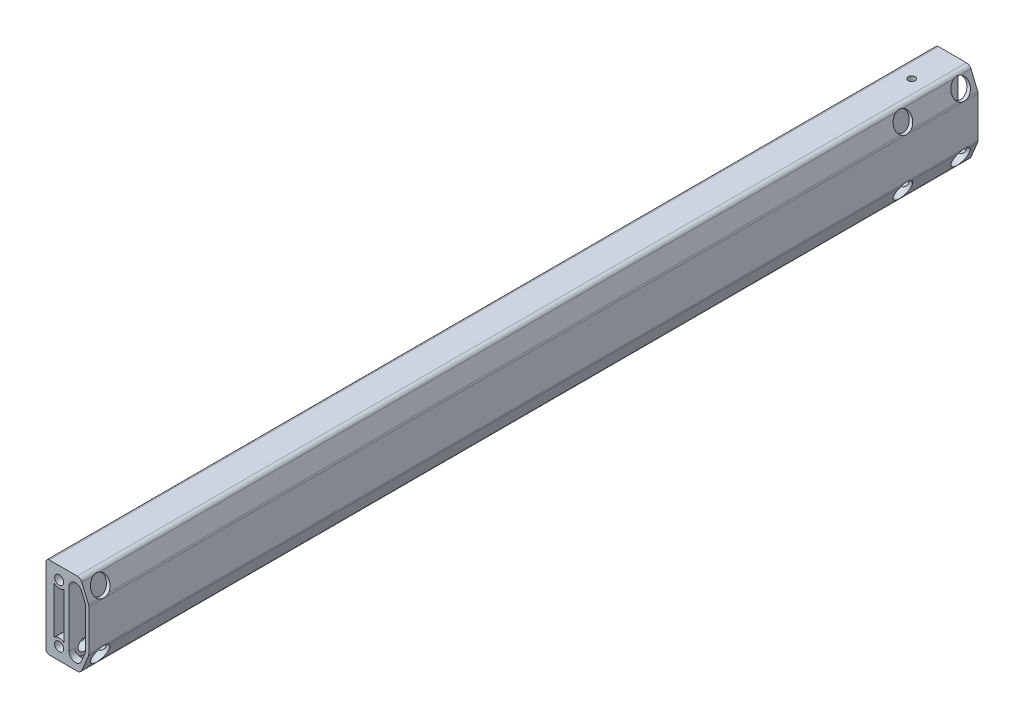
from build123d import *

# Parameters (mm, degrees)
SKETCH_1_R             = 2.75
EXTRUDE_1_DEPTH        = 540
CUT_EXTRUDE_2_DEPTH    = 2.5
SKETCH_3_R             = 3.5
CUT_EXTRUDE_3_DEPTH    = 1297.387836991
SKETCH_4_R             = 5.5
CUT_EXTRUDE_4_DEPTH    = 12
HOLE_WIZARD_M5_1_D     = 4.2
HOLE_WIZARD_M5_1_DEPTH = 12.4
HOLE_WIZARD_M5_1_TIP   = 1.2618073
HOLE_WIZARD_M5_2_D     = 4.2
HOLE_WIZARD_M5_2_DEPTH = 12.4
HOLE_WIZARD_M5_2_TIP   = 1.2618073


with BuildPart() as part:
    # 草图1 → 拉伸1 (new body)
    with BuildSketch(Plane.XY):
        with BuildLine():
            Line((1279.954850036, 1143.28070675), (1279.954850036, 1130.28070675))
            ThreePointArc((1279.954850036, 1130.28070675), (1280.540636473, 1128.866493188), (1281.954850036, 1128.28070675))
            Line((1281.954850036, 1128.28070675), (1298.954850036, 1128.28070675))
            ThreePointArc((1298.954850036, 1128.28070675), (1300.618950624, 1128.784555867), (1301.724080805, 1130.126860596))
            Line((1301.724080805, 1130.126860596), (1305.724080805, 1139.726860596))
            ThreePointArc((1305.724080805, 1139.726860596), (1305.896592063, 1140.292358345), (1305.954850036, 1140.88070675))
            Line((1305.954850036, 1140.88070675), (1305.954850036, 1165.68070675))
            ThreePointArc((1305.954850036, 1165.68070675), (1305.896592063, 1166.269055155), (1305.724080805, 1166.834552904))
            Line((1305.724080805, 1166.834552904), (1301.724080805, 1176.434552904))
            ThreePointArc((1301.724080805, 1176.434552904), (1300.618950624, 1177.776857633), (1298.954850036, 1178.28070675))
            Line((1298.954850036, 1178.28070675), (1281.954850036, 1178.28070675))
            ThreePointArc((1281.954850036, 1178.28070675), (1280.540636473, 1177.694920312), (1279.954850036, 1176.28070675))
            Line((1279.954850036, 1176.28070675), (1279.954850036, 1163.28070675))
            Line((1279.954850036, 1163.28070675), (1279.954850036, 1143.28070675))
        make_face()
        with Locations((1287.954850036, 1135.78070675)):
            Circle(SKETCH_1_R, mode=Mode.SUBTRACT)
        with Locations((1287.954850036, 1170.78070675)):
            Circle(SKETCH_1_R, mode=Mode.SUBTRACT)
        with BuildLine():
            Line((1284.954850036, 1167.426604784), (1284.954850036, 1139.134808716))
            ThreePointArc((1284.954850036, 1139.134808716), (1287.954850036, 1140.28070675), (1290.954850036, 1139.134808716))
            Line((1290.954850036, 1139.134808716), (1290.954850036, 1167.426604784))
            ThreePointArc((1290.954850036, 1167.426604784), (1287.954850036, 1166.28070675), (1284.954850036, 1167.426604784))
        make_face(mode=Mode.SUBTRACT)
        with BuildLine():
            Line((1293.954850036, 1170.38070675), (1293.954850036, 1136.18070675))
            ThreePointArc((1293.954850036, 1136.18070675), (1297.089997109, 1132.356442115), (1301.454850036, 1134.68070675))
            Line((1301.454850036, 1134.68070675), (1303.877926959, 1140.496091365))
            ThreePointArc((1303.877926959, 1140.496091365), (1303.935430711, 1140.684590615), (1303.954850036, 1140.88070675))
            Line((1303.954850036, 1140.88070675), (1303.954850036, 1165.68070675))
            ThreePointArc((1303.954850036, 1165.68070675), (1303.935430711, 1165.876822885), (1303.877926959, 1166.065322135))
            Line((1303.877926959, 1166.065322135), (1301.454850036, 1171.88070675))
            ThreePointArc((1301.454850036, 1171.88070675), (1297.089997109, 1174.204971385), (1293.954850036, 1170.38070675))
        make_face(mode=Mode.SUBTRACT)
    extrude(amount=-EXTRUDE_1_DEPTH)

    # 草图2 → 拉伸2 (cut)
    with BuildSketch(Plane.ZY.offset(-1279.954850036)):
        with BuildLine():
            Line((-540, 1163.28070675), (-485, 1163.28070675))
            ThreePointArc((-485, 1163.28070675), (-475, 1153.28070675), (-485, 1143.28070675))
            Line((-485, 1143.28070675), (-540, 1143.28070675))
            Line((-540, 1143.28070675), (-540, 1163.28070675))
        make_face()
    extrude(amount=-CUT_EXTRUDE_2_DEPTH, mode=Mode.SUBTRACT)

    # 草图3 → 拉伸3 (cut, through all)
    with BuildSketch(Plane(origin=(1305.954850036, 0, 0), x_dir=(0, 0, -1), z_dir=(1, 0, 0))):
        with Locations(Location((531.5, 1171.28070675, 0), (0, 0, 90))):
            Circle(SKETCH_3_R)
        with Locations(Location((496.5, 1171.28070675, 0), (0, 0, 90))):
            Circle(SKETCH_3_R)
        with Locations(Location((531.5, 1135.28070675, 0), (0, 0, 90))):
            Circle(SKETCH_3_R)
        with Locations(Location((496.5, 1135.28070675, 0), (0, 0, 90))):
            Circle(SKETCH_3_R)
        with Locations(Location((9, 1171.28070675, 0), (0, 0, 90))):
            Circle(SKETCH_3_R)
        with Locations(Location((9, 1135.28070675, 0), (0, 0, 90))):
            Circle(SKETCH_3_R)
    extrude(amount=-CUT_EXTRUDE_3_DEPTH, mode=Mode.SUBTRACT)

    # 草图4 → 拉伸4 (cut)
    with BuildSketch(Plane(origin=(1305.954850036, 0, 0), x_dir=(0, 0, -1), z_dir=(1, 0, 0))):
        with Locations(Location((496.5, 1171.28070675, 0), (0, 0, 69.564033963))):
            Circle(SKETCH_4_R)
        with Locations(Location((531.5, 1171.28070675, 0), (0, 0, 69.564033963))):
            Circle(SKETCH_4_R)
        with Locations(Location((496.5, 1135.28070675, 0), (0, 0, 108.512979231))):
            Circle(SKETCH_4_R)
        with Locations(Location((531.5, 1135.28070675, 0), (0, 0, 108.512979231))):
            Circle(SKETCH_4_R)
        with Locations(Location((9, 1171.28070675, 0), (0, 0, 69.564033963))):
            Circle(SKETCH_4_R)
        with Locations(Location((9, 1135.28070675, 0), (0, 0, 108.512979231))):
            Circle(SKETCH_4_R)
    extrude(amount=-CUT_EXTRUDE_4_DEPTH, mode=Mode.SUBTRACT)

    # M5 螺纹孔1
    with Locations(Plane(origin=(0, 1178.28070675, 0), x_dir=(-1, 0, 0), z_dir=(0, 1, 0))):
        with Locations((-1290.704850036, -515)):
            Hole(HOLE_WIZARD_M5_1_D / 2, depth=HOLE_WIZARD_M5_1_DEPTH)
            with Locations((0, 0, -(HOLE_WIZARD_M5_1_DEPTH + HOLE_WIZARD_M5_1_TIP / 2))):  # 118° drill point
                Cone(0, HOLE_WIZARD_M5_1_D / 2, HOLE_WIZARD_M5_1_TIP, mode=Mode.SUBTRACT)

    # M5 螺纹孔2
    with Locations(Plane.XZ.offset(-1128.28070675)):
        with Locations((1290.704850036, -515)):
            Hole(HOLE_WIZARD_M5_2_D / 2, depth=HOLE_WIZARD_M5_2_DEPTH)
            with Locations((0, 0, -(HOLE_WIZARD_M5_2_DEPTH + HOLE_WIZARD_M5_2_TIP / 2))):  # 118° drill point
                Cone(0, HOLE_WIZARD_M5_2_D / 2, HOLE_WIZARD_M5_2_TIP, mode=Mode.SUBTRACT)


solid = part.part
